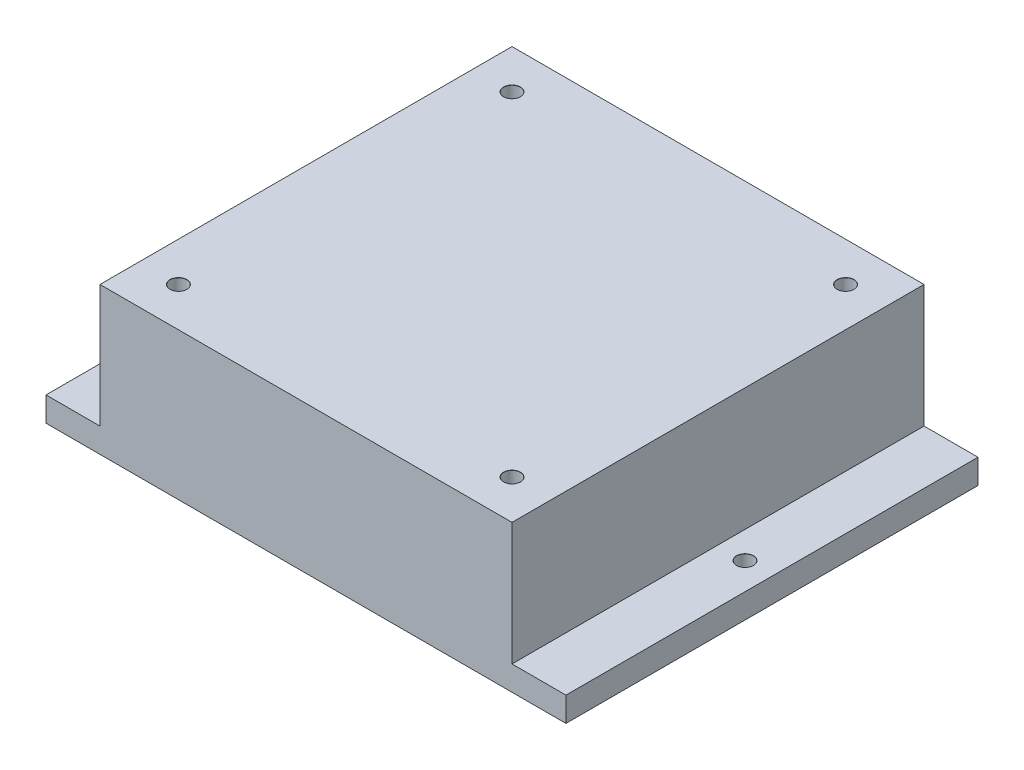
from build123d import *

# Parameters (mm, degrees)
SKETCH1_W                      = 106
SKETCH1_H                      = 84
BOSS_EXTRUDE1_DEPTH            = 30
SKETCH2_W                      = 11
SKETCH2_H                      = 25
CUT_EXTRUDE1_DEPTH             = 104.754517974
M3_CLEARANCE_HOLE1_D           = 3.4
M3_CLEARANCE_HOLE1_DEPTH       = 10
M3_CLEARANCE_HOLE1_CSINK_D     = 3.45
M3_CLEARANCE_HOLE1_CSINK_ANGLE = 90
M3_CLEARANCE_HOLE1_TIP         = 1.021463052
M3_CLEARANCE_HOLE2_D           = 3.4
M3_CLEARANCE_HOLE2_CSINK_D     = 3.45
M3_CLEARANCE_HOLE2_CSINK_ANGLE = 90


with BuildPart() as part:
    # Sketch1 → Boss-Extrude1 (new body)
    with BuildSketch(Plane(origin=(0, 0, 0), x_dir=(1, 0, 0), z_dir=(0, 1, 0))):
        Rectangle(SKETCH1_W, SKETCH1_H)
    extrude(amount=BOSS_EXTRUDE1_DEPTH)

    # Sketch2 → Cut-Extrude1 (cut, through all)
    with BuildSketch(Plane.XY.offset(42)):
        with Locations((47.5, 17.5)):
            Rectangle(SKETCH2_W, SKETCH2_H)
        with Locations((-47.5, 17.5)):
            Rectangle(SKETCH2_W, SKETCH2_H)
    extrude(amount=-CUT_EXTRUDE1_DEPTH, mode=Mode.SUBTRACT)

    # M3 Clearance Hole1
    with Locations(Plane(origin=(0, 30, 0), x_dir=(1, 0, 0), z_dir=(0, 1, 0))):
        with Locations((-34, 34), (34, 34), (34, -34), (-34, -34)):
            CounterSinkHole(M3_CLEARANCE_HOLE1_D / 2, M3_CLEARANCE_HOLE1_CSINK_D / 2, depth=M3_CLEARANCE_HOLE1_DEPTH, counter_sink_angle=M3_CLEARANCE_HOLE1_CSINK_ANGLE)
            with Locations((0, 0, -(M3_CLEARANCE_HOLE1_DEPTH + M3_CLEARANCE_HOLE1_TIP / 2))):  # 118° drill point
                Cone(0, M3_CLEARANCE_HOLE1_D / 2, M3_CLEARANCE_HOLE1_TIP, mode=Mode.SUBTRACT)

    # M3 Clearance Hole2 (through all)
    with Locations(Plane(origin=(0, 5, 0), x_dir=(1, 0, 0), z_dir=(0, 1, 0))):
        with Locations((-47.5, 0), (47.5, 0)):
            CounterSinkHole(M3_CLEARANCE_HOLE2_D / 2, M3_CLEARANCE_HOLE2_CSINK_D / 2, counter_sink_angle=M3_CLEARANCE_HOLE2_CSINK_ANGLE)


solid = part.part
